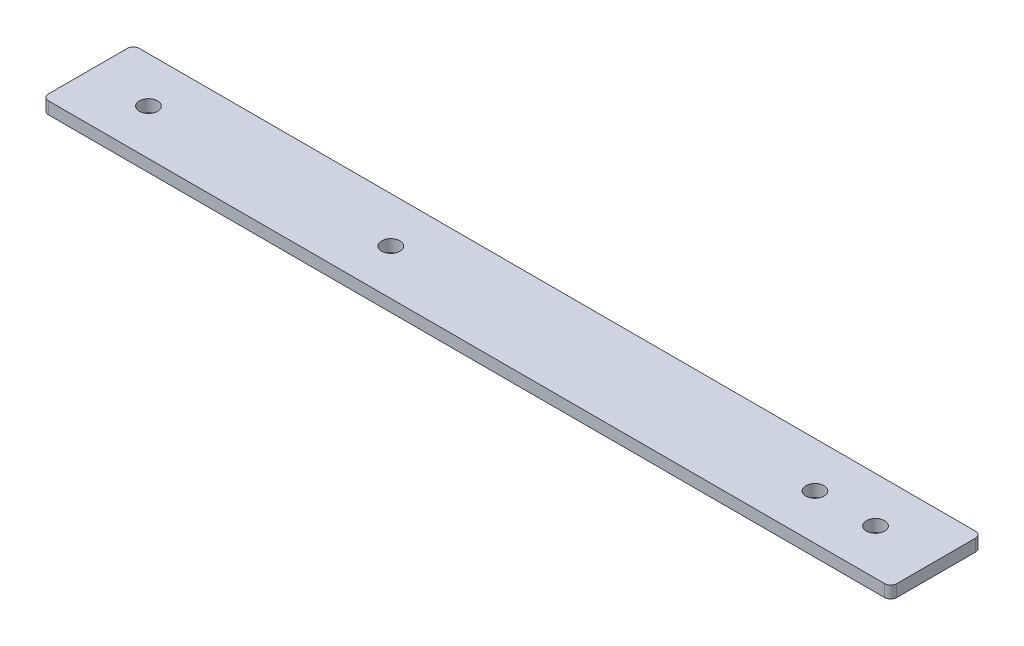
from build123d import *

# Parameters (mm, degrees)
BOSS_EXTRUDE1_DEPTH = 2
FILLET1_R           = 1
SKETCH2_R           = 1.5
CUT_EXTRUDE1_DEPTH  = 10


with BuildPart() as part:
    # Sketch1 → Boss-Extrude1 (new body)
    with BuildSketch(Plane(origin=(0, 0, 0), x_dir=(1, 0, 0), z_dir=(0, 1, 0))):
        with BuildLine():
            ThreePointArc((48.5, 7.5), (50, 9), (51.5, 7.5))
            Line((51.5, 7.5), (140, 7.5))
            Line((140, 7.5), (140, 15))
            Line((140, 15), (0, 15))
            Line((0, 15), (0, 7.5))
            Line((0, 7.5), (8.5, 7.5))
            ThreePointArc((8.5, 7.5), (10, 9), (11.5, 7.5))
            Line((11.5, 7.5), (48.5, 7.5))
        make_face()
        with BuildLine():
            Line((140, 7.5), (51.5, 7.5))
            ThreePointArc((51.5, 7.5), (50, 6), (48.5, 7.5))
            Line((48.5, 7.5), (11.5, 7.5))
            ThreePointArc((11.5, 7.5), (10, 6), (8.5, 7.5))
            Line((8.5, 7.5), (0, 7.5))
            Line((0, 7.5), (0, 0))
            Line((0, 0), (140, 0))
            Line((140, 0), (140, 7.5))
        make_face()
    extrude(amount=BOSS_EXTRUDE1_DEPTH)

    # Fillet1
    fillet1_edges = [part.edges().sort_by_distance(p)[0] for p in [
        (0, 1, 0),
        (0, 1, -15),
        (140, 1, -15),
        (140, 1, 0),
    ]]
    fillet(fillet1_edges, radius=FILLET1_R)

    # Sketch2 → Cut-Extrude1 (cut)
    with BuildSketch(Plane(origin=(0, 2, 0), x_dir=(1, 0, 0), z_dir=(0, 1, 0))):
        with Locations(Location((130, 7.5, 0), (0, 0, 270))):
            Circle(SKETCH2_R)
        with Locations(Location((120, 7.5, 0), (0, 0, 270))):
            Circle(SKETCH2_R)
    extrude(amount=-CUT_EXTRUDE1_DEPTH, mode=Mode.SUBTRACT)


solid = part.part
